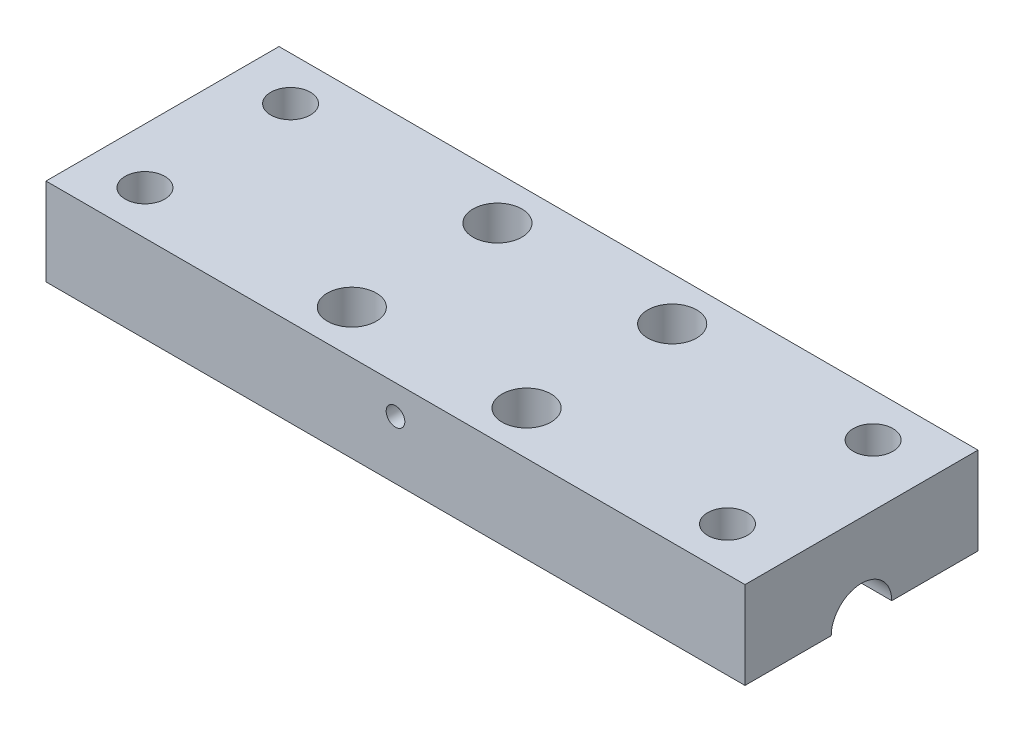
from build123d import *

# Parameters (mm, degrees)
SKETCH1_W           = 76.2
SKETCH1_H           = 25.4
BOSS_EXTRUDE1_DEPTH = 9.525
SKETCH2_R           = 2.159
CUT_EXTRUDE1_DEPTH  = 42.275
SKETCH3_R           = 2.667
CUT_EXTRUDE2_DEPTH  = 42.275
SKETCH4_R           = 1.016
CUT_EXTRUDE3_DEPTH  = 7.62
CUT_EXTRUDE4_START  = -7.62
SKETCH5_R           = 1.016
CUT_EXTRUDE4_DEPTH  = 7.62
SKETCH7_R           = 3.302
CUT_EXTRUDE5_DEPTH  = 78.836081768


with BuildPart() as part:
    # Sketch1 → Boss-Extrude1 (new body)
    with BuildSketch(Plane(origin=(0, 0, 0), x_dir=(1, 0, 0), z_dir=(0, 1, 0))):
        Rectangle(SKETCH1_W, SKETCH1_H)
    extrude(amount=BOSS_EXTRUDE1_DEPTH)

    # Sketch2 → Cut-Extrude1 (cut, through all)
    with BuildSketch(Plane(origin=(0, 9.525, 0), x_dir=(1, 0, 0), z_dir=(0, 1, 0))):
        with Locations(Location((-32.074075882, 7.9375, 0), (0, 0, 270))):
            Circle(SKETCH2_R)
        with Locations(Location((-32.074075882, -7.9375, 0), (0, 0, 270))):
            Circle(SKETCH2_R)
        with Locations(Location((31.425924118, 7.9375, 0), (0, 0, 270))):
            Circle(SKETCH2_R)
        with Locations(Location((31.425924118, -7.9375, 0), (0, 0, 270))):
            Circle(SKETCH2_R)
    extrude(amount=-CUT_EXTRUDE1_DEPTH, mode=Mode.SUBTRACT)

    # Sketch3 → Cut-Extrude2 (cut, through all)
    with BuildSketch(Plane(origin=(0, 9.525, 0), x_dir=(1, 0, 0), z_dir=(0, 1, 0))):
        with Locations(Location((-9.525, 7.9375, 0), (0, 0, 270))):
            Circle(SKETCH3_R)
        with Locations(Location((-9.525, -7.9375, 0), (0, 0, 270))):
            Circle(SKETCH3_R)
        with Locations(Location((9.525, 7.9375, 0), (0, 0, 270))):
            Circle(SKETCH3_R)
        with Locations(Location((9.525, -7.9375, 0), (0, 0, 270))):
            Circle(SKETCH3_R)
    extrude(amount=-CUT_EXTRUDE2_DEPTH, mode=Mode.SUBTRACT)

    # Sketch4 → Cut-Extrude3 (cut)
    with BuildSketch(Plane.XY.offset(12.7)):
        with Locations((0, 6.35)):
            Circle(SKETCH4_R)
    extrude(amount=-CUT_EXTRUDE3_DEPTH, mode=Mode.SUBTRACT)

    # Sketch5 → Cut-Extrude4 (cut)
    with BuildSketch(Plane(origin=(0, 0, -12.7), x_dir=(-1, 0, 0), z_dir=(0, 0, -1)).offset(CUT_EXTRUDE4_START)):
        with Locations(Location((0, 6.35, 0), (0, 0, 180))):
            Circle(SKETCH5_R)
    extrude(amount=CUT_EXTRUDE4_DEPTH, mode=Mode.SUBTRACT)

    # Sketch7 → Cut-Extrude5 (cut, through all)
    with BuildSketch(Plane(origin=(38.1, 0, 0), x_dir=(0, 0, -1), z_dir=(1, 0, 0))):
        Circle(SKETCH7_R)
    extrude(amount=-CUT_EXTRUDE5_DEPTH, mode=Mode.SUBTRACT)


solid = part.part
